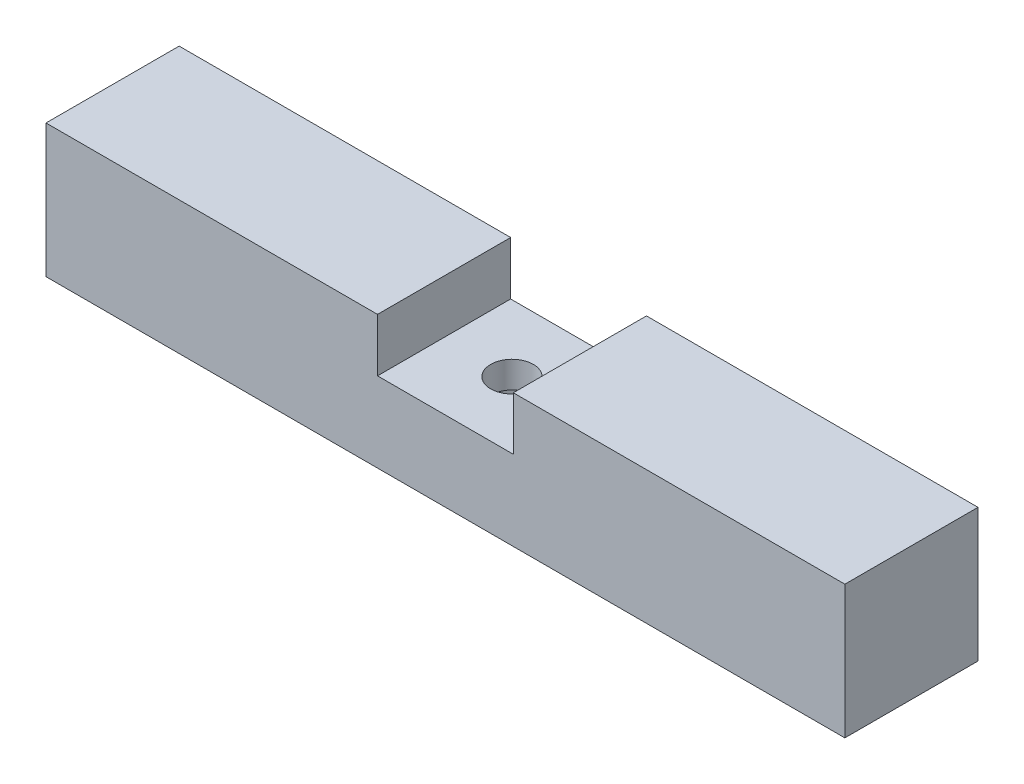
from build123d import *

# Parameters (mm, degrees)
BOSS_EXTRUDE1_DEPTH = 10
SKETCH2_R           = 1.6
CUT_EXTRUDE1_DEPTH  = 10
SKETCH3_R           = 3
CUT_EXTRUDE2_DEPTH  = 4


with BuildPart() as part:
    # Sketch1 → Boss-Extrude1 (new body)
    with BuildSketch(Plane.XY):
        Polygon((-5.1, 10), (-5.1, 6), (5.1, 6), (5.1, 10), (30, 10), (30, 0), (-30, 0), (-30, 10), align=None)
    extrude(amount=BOSS_EXTRUDE1_DEPTH)

    # Sketch2 → Cut-Extrude1 (cut)
    with BuildSketch(Plane(origin=(0, 6, 0), x_dir=(1, 0, 0), z_dir=(0, 1, 0))):
        with Locations(Location((0, -5, 0), (0, 0, 270))):
            Circle(SKETCH2_R)
    extrude(amount=-CUT_EXTRUDE1_DEPTH, mode=Mode.SUBTRACT)

    # Sketch3 → Cut-Extrude2 (cut)
    with BuildSketch(Plane.XZ):
        with Locations((0, 5)):
            Circle(SKETCH3_R)
    extrude(amount=-CUT_EXTRUDE2_DEPTH, mode=Mode.SUBTRACT)


solid = part.part
